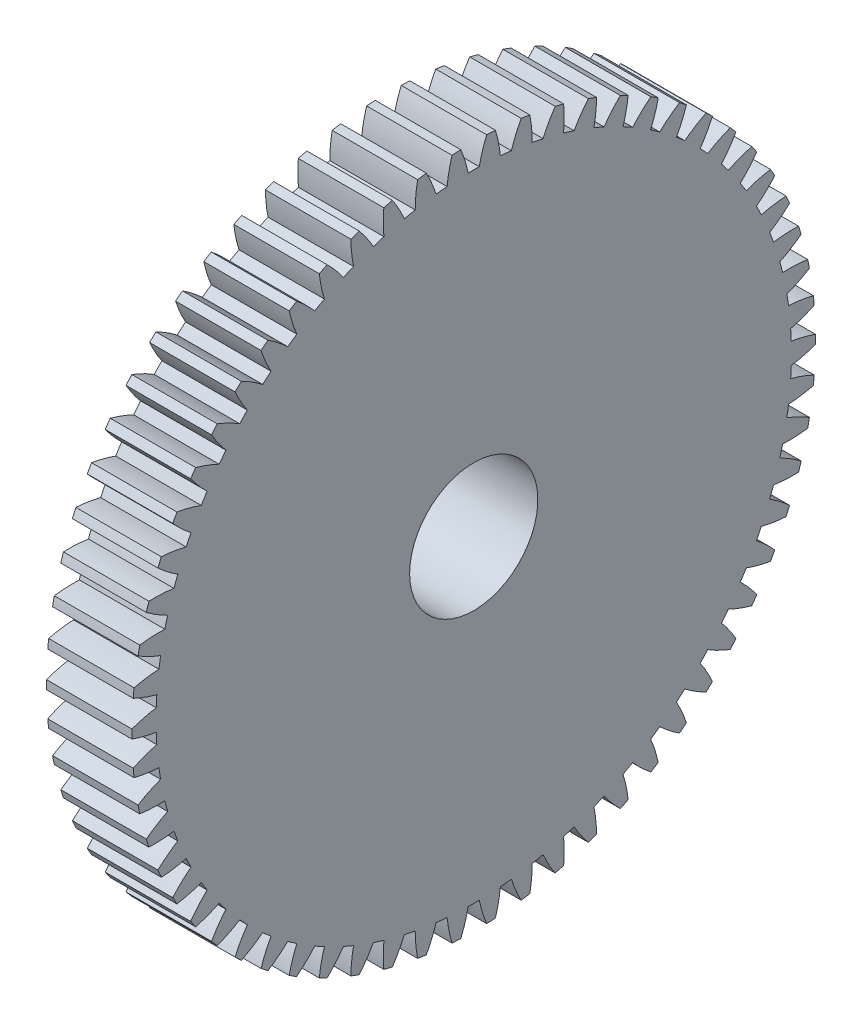
from build123d import *

# Parameters (mm, degrees)
BASPROSKE_W      = 6.35
BASPROSKE_H      = 25.4
TOOTHCUT_DEPTH   = 37.477972806
TEETHCUTS_COUNT  = 62
TEETHCUTS_ANGLE  = 354.193548387
HUBNEAONESKE_R   = 7.9375
HUBNEARONE_DEPTH = 9.5250508
BORSKE_R         = 4.7625
BORE_DEPTH       = 15.8750508


with BuildPart() as part:
    # BasProSke → Base-Revolve (revolve)
    with BuildSketch(Plane(origin=(0, 0, 0), x_dir=(1, 0, 0), z_dir=(0, 1, 0)), mode=Mode.PRIVATE) as base_revolve_sk:
        with Locations((3.175, 12.7)):
            Rectangle(BASPROSKE_W, BASPROSKE_H)
    revolve(base_revolve_sk.sketch.rotate(Axis((-10, 0, 0), (1, 0, 0)), 180), axis=Axis((-10, 0, 0), (1, 0, 0)))

    # TooCutSke → ToothCut (cut, through all)
    with BuildSketch(Plane(origin=(0, 0, 0), x_dir=(0, 0, -1), z_dir=(1, 0, 0))):
        with BuildLine():
            ThreePointArc((0.410902926, 23.599373032), (0, 23.60295), (-0.410902926, 23.599373032))
            ThreePointArc((-0.410902926, 23.599373032), (-0.647788076, 24.516609073), (-0.971756796, 25.406822979))
            ThreePointArc((-0.971756796, 25.406822979), (0, 25.4254), (0.971756796, 25.406822979))
            ThreePointArc((0.971756796, 25.406822979), (0.647788076, 24.516609073), (0.410902926, 23.599373032))
        make_face()
    toothcut = extrude(amount=TOOTHCUT_DEPTH, mode=Mode.SUBTRACT)

    # TeethCuts: ToothCut ×62 about axis
    teethcuts_axis = Axis((-10, 0, 0), (1, 0, 0))
    for i in range(1, TEETHCUTS_COUNT):
        add(toothcut.rotate(teethcuts_axis, i * TEETHCUTS_ANGLE / (TEETHCUTS_COUNT - 1)), mode=Mode.SUBTRACT)

    # HubNeaOneSke → HubNearOne (add)
    with BuildSketch(Plane.ZY):
        with Locations(Location((0, 0, 0), (0, 0, 180))):
            Circle(HUBNEAONESKE_R)
    extrude(amount=HUBNEARONE_DEPTH)

    # BorSke → Bore (cut, symmetric)
    with BuildSketch(Plane(origin=(0, 0, 0), x_dir=(0, 0, -1), z_dir=(1, 0, 0))):
        with Locations(Location((0, 0, 0), (0, 0, 180))):
            Circle(BORSKE_R)
    extrude(amount=BORE_DEPTH, both=True, mode=Mode.SUBTRACT)


solid = part.part
